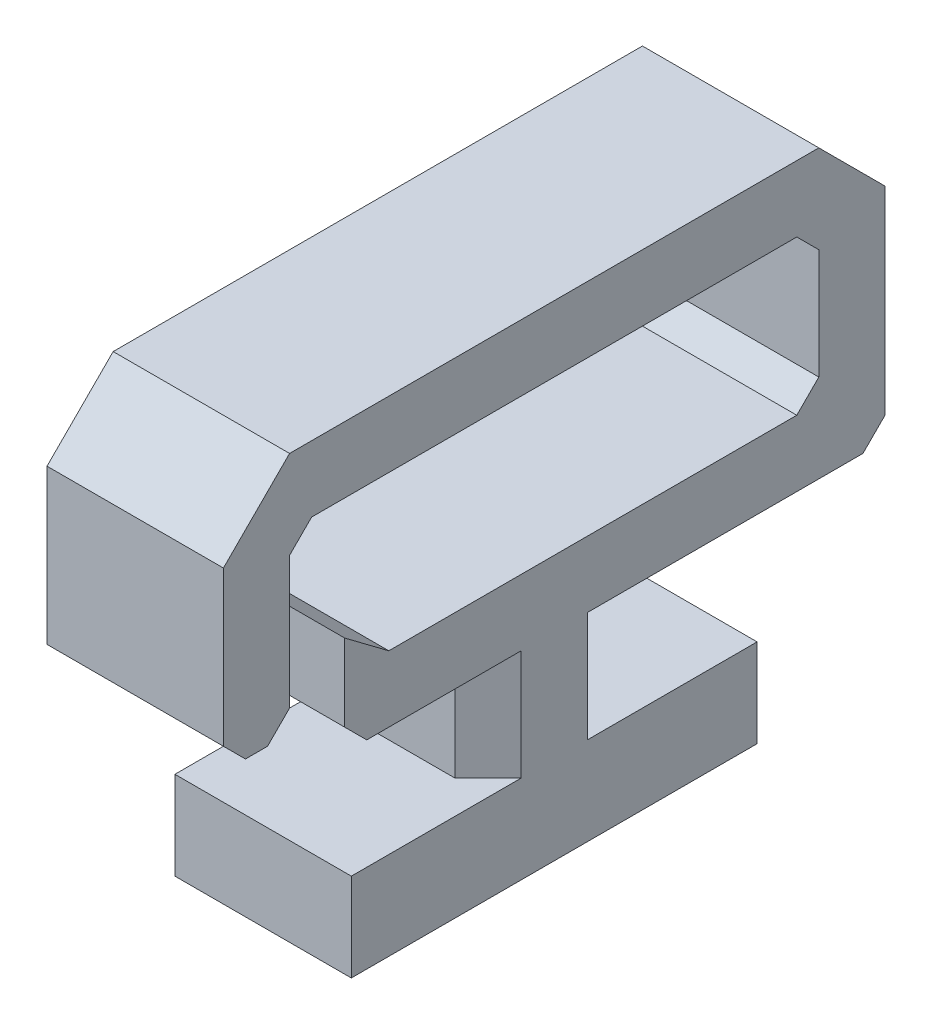
from build123d import *

# Parameters (mm, degrees)
BOSS_EXTRUDE1_DEPTH = 4
CHAMFER1_SIZE       = 0.75
SKETCH2_W           = 1.5
SKETCH2_H           = 1
CUT_EXTRUDE1_DEPTH  = 14.901438774
CHAMFER2_SIZE       = 1.5
CHAMFER3_SIZE       = 0.5


with BuildPart() as part:
    # Sketch1 → Boss-Extrude1 (new body)
    with BuildSketch(Plane(origin=(0, 0, 0), x_dir=(0, 0, -1), z_dir=(1, 0, 0))):
        Polygon((-4.6, 0), (4.6, 0), (4.6, 2), (1.5, 2), (1.5, 4.5), (7.5, 4.5), (7.5, 11), (-7.5, 11), (-7.5, 4.5), (-6, 4.5), (-6, 6), (-6, 9.5), (6, 9.5), (6, 6), (-3.75, 6), (-4.75, 6.75), (-4.75, 6), (-4.75, 4.5), (-1.5, 4.5), (-1.5, 2), (-4.6, 2), align=None)
    extrude(amount=BOSS_EXTRUDE1_DEPTH)

    # Chamfer1
    chamfer1_edges = [part.edges().sort_by_distance(p)[0] for p in [
        (0, 3.25, 1.5),
        (0, 3.25, -1.5),
        (4, 3.25, 1.5),
        (4, 3.25, -1.5),
    ]]
    chamfer(chamfer1_edges, length=CHAMFER1_SIZE)

    # Sketch2 → Cut-Extrude1 (cut, through all)
    with BuildSketch(Plane.ZY):
        with Locations((6.75, 5)):
            Rectangle(SKETCH2_W, SKETCH2_H)
    extrude(amount=-CUT_EXTRUDE1_DEPTH, mode=Mode.SUBTRACT)

    # Chamfer2
    chamfer2_edges = [part.edges().sort_by_distance(p)[0] for p in [
        (2, 11, 7.5),
        (2, 11, -7.5),
    ]]
    chamfer(chamfer2_edges, length=CHAMFER2_SIZE)

    # Chamfer3
    chamfer3_edges = [part.edges().sort_by_distance(p)[0] for p in [
        (2, 5.5, 6),
        (2, 5.5, 7.5),
        (2, 4.5, 4.75),
        (2, 6, -6),
        (2, 9.5, -6),
        (2, 9.5, 6),
        (2, 4.5, -7.5),
    ]]
    chamfer(chamfer3_edges, length=CHAMFER3_SIZE)


solid = part.part
